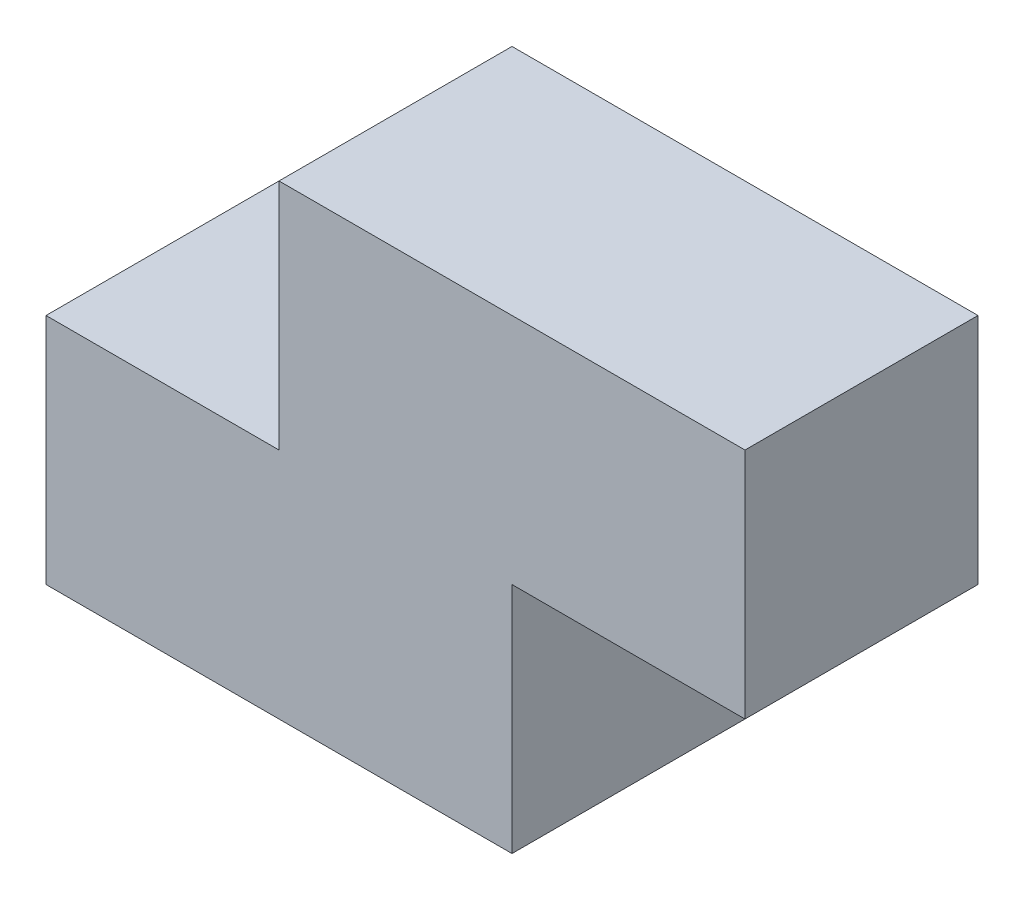
from build123d import *

# Parameters (mm, degrees)
BOSS_EXTRU_1_DEPTH = 300


with BuildPart() as part:
    # Esquisse1 → Boss.-Extru.1 (new body)
    with BuildSketch(Plane.XY):
        Polygon((0, 0), (600, 0), (600, 300), (900, 300), (900, 600), (300, 600), (300, 300), (0, 300), align=None)
    extrude(amount=BOSS_EXTRU_1_DEPTH)


solid = part.part
